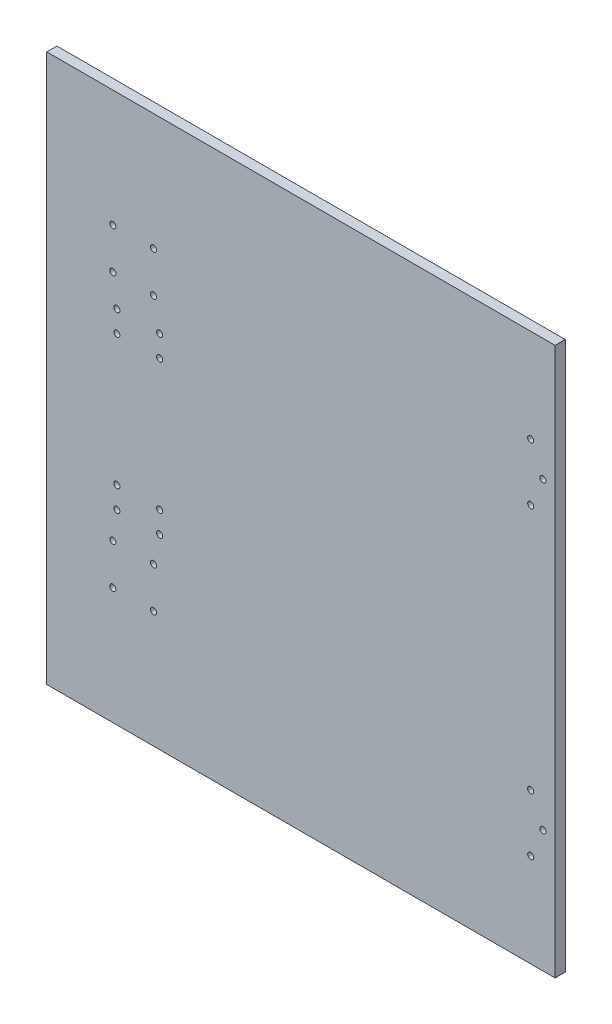
from build123d import *

# Parameters (mm, degrees)
ESQUISSE1_W             = 250
ESQUISSE1_H             = 269.43
BOSS_EXTRU_1_DEPTH      = 5
ESQUISSE3_R             = 1.5
ENL_V_MAT_EXTRU_2_DEPTH = 184.84268064
ESQUISSE4_R             = 1.5
ENL_V_MAT_EXTRU_3_DEPTH = 184.84268064


with BuildPart() as part:
    # Esquisse1 → Boss.-Extru.1 (new body)
    with BuildSketch(Plane.XY):
        Rectangle(ESQUISSE1_W, ESQUISSE1_H)
    extrude(amount=BOSS_EXTRU_1_DEPTH)

    # Esquisse3 → Enlèv. mat.-Extru.2 (cut, through all)
    with BuildSketch(Plane(origin=(0, 0, 0), x_dir=(-1, 0, 0), z_dir=(0, 0, -1))):
        with Locations((72.5, 77.215)):
            Circle(ESQUISSE3_R)
        with Locations((92.5, 77.215)):
            Circle(ESQUISSE3_R)
        with Locations((92.5, 57.215)):
            Circle(ESQUISSE3_R)
        with Locations((72.5, 57.215)):
            Circle(ESQUISSE3_R)
        with Locations((72.5, -57.215)):
            Circle(ESQUISSE3_R)
        with Locations((92.5, -57.215)):
            Circle(ESQUISSE3_R)
        with Locations((72.5, -77.215)):
            Circle(ESQUISSE3_R)
        with Locations((92.5, -77.215)):
            Circle(ESQUISSE3_R)
        with Locations((-113, 88.715)):
            Circle(ESQUISSE3_R)
        with Locations((-119, 74.715)):
            Circle(ESQUISSE3_R)
        with Locations((-113, 60.715)):
            Circle(ESQUISSE3_R)
        with Locations((-113, -60.715)):
            Circle(ESQUISSE3_R)
        with Locations((-119, -74.715)):
            Circle(ESQUISSE3_R)
        with Locations((-113, -88.715)):
            Circle(ESQUISSE3_R)
    extrude(amount=-ENL_V_MAT_EXTRU_2_DEPTH, mode=Mode.SUBTRACT)

    # Esquisse4 → Enlèv. mat.-Extru.3 (cut, through all)
    with BuildSketch(Plane.XY.offset(5)):
        with Locations((-69.472135955, -43.048932022)):
            Circle(ESQUISSE4_R)
        with Locations((-69.472135955, -32.521067977)):
            Circle(ESQUISSE4_R)
        with Locations((-90.527864045, -43.048932022)):
            Circle(ESQUISSE4_R)
        with Locations((-90.527864045, -32.521067977)):
            Circle(ESQUISSE4_R)
        with Locations((-69.472135955, 31.951067978)):
            Circle(ESQUISSE4_R)
        with Locations((-90.527864045, 31.951067978)):
            Circle(ESQUISSE4_R)
        with Locations((-69.472135955, 42.478932023)):
            Circle(ESQUISSE4_R)
        with Locations((-90.527864045, 42.478932023)):
            Circle(ESQUISSE4_R)
    extrude(amount=-ENL_V_MAT_EXTRU_3_DEPTH, mode=Mode.SUBTRACT)


solid = part.part
